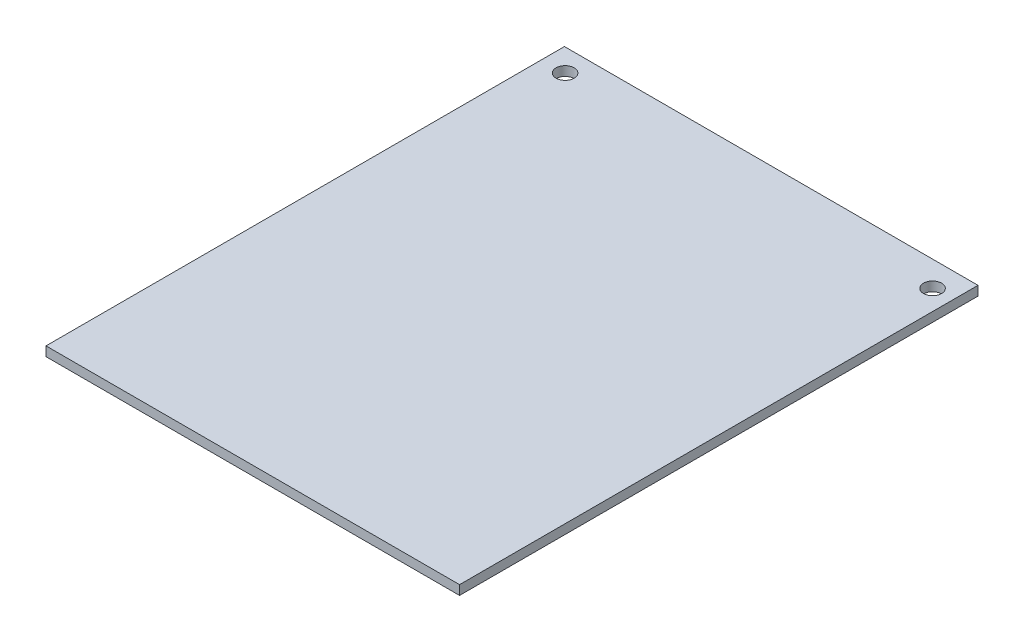
from build123d import *

# Parameters (mm, degrees)
SKETCH1_W           = 73.26
SKETCH1_H           = 91.84
SKETCH1_R           = 1.6
BOSS_EXTRUDE1_DEPTH = 1.66


with BuildPart() as part:
    # Sketch1 → Boss-Extrude1 (new body)
    with BuildSketch(Plane(origin=(0, 0, 0), x_dir=(1, 0, 0), z_dir=(0, 1, 0))):
        with Locations((-5.402592593, -8.260740741)):
            Rectangle(SKETCH1_W, SKETCH1_H)
        with Locations(Location((27.667407407, 33.169259259, 0), (0, 0, 90))):
            Circle(SKETCH1_R, mode=Mode.SUBTRACT)
        with Locations(Location((-37.912592593, 33.659259259, 0), (0, 0, 90))):
            Circle(SKETCH1_R, mode=Mode.SUBTRACT)
    extrude(amount=BOSS_EXTRUDE1_DEPTH)


solid = part.part
